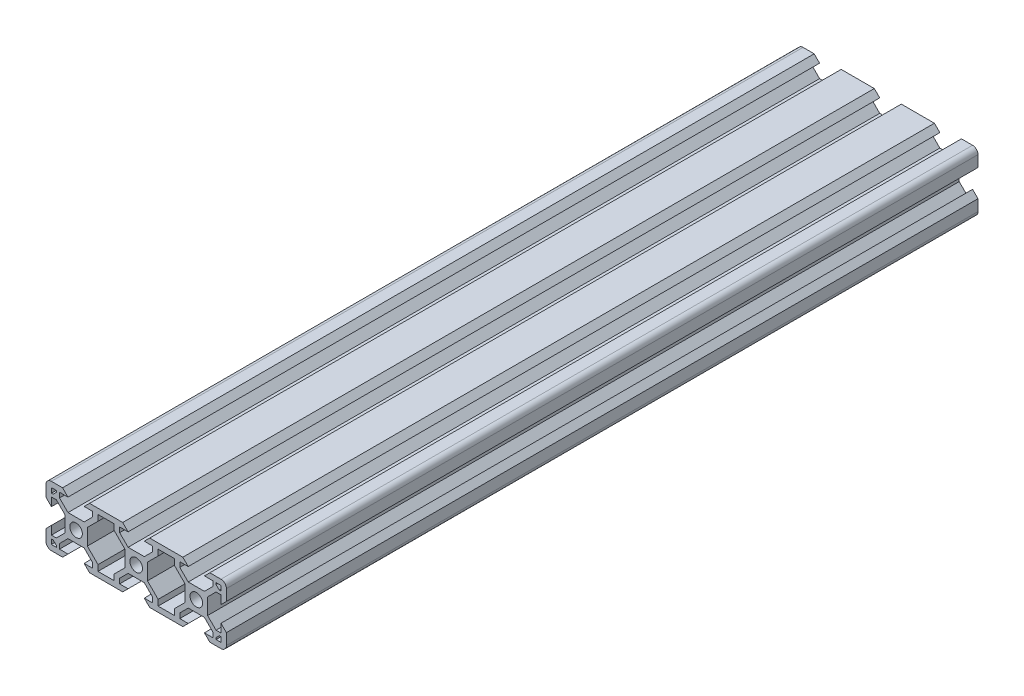
from build123d import *

# Parameters (mm, degrees)
ESQUISSE1_R        = 2.1
BOSS_EXTRU_1_DEPTH = 125


with BuildPart() as part:
    # Esquisse1 → Boss.-Extru.1 (new, symmetric)
    with BuildSketch(Plane.XY):
        with BuildLine():
            Line((-20, 3.750660172), (-22.69, 3.750660172))
            Line((-22.69, 3.750660172), (-25.499339828, 6.56))
            Line((-25.499339828, 6.56), (-25.499339828, 8.2))
            Line((-25.499339828, 8.2), (-22.69, 8.2))
            Line((-22.69, 8.2), (-24.49, 10))
            Line((-24.49, 10), (-28.2, 10))
            ThreePointArc((-28.2, 10), (-29.472792206, 9.472792206), (-30, 8.2))
            Line((-30, 8.2), (-30, 4.49))
            Line((-30, 4.49), (-28.2, 2.69))
            Line((-28.2, 2.69), (-28.2, 5.499339828))
            Line((-28.2, 5.499339828), (-26.56, 5.499339828))
            Line((-26.56, 5.499339828), (-23.750660172, 2.69))
            Line((-23.750660172, 2.69), (-23.750660172, 0))
            Line((-23.750660172, 0), (-23.750660172, -2.69))
            Line((-23.750660172, -2.69), (-26.56, -5.499339828))
            Line((-26.56, -5.499339828), (-28.2, -5.499339828))
            Line((-28.2, -5.499339828), (-28.2, -2.69))
            Line((-28.2, -2.69), (-30, -4.49))
            Line((-30, -4.49), (-30, -8.2))
            ThreePointArc((-30, -8.2), (-29.472792206, -9.472792206), (-28.2, -10))
            Line((-28.2, -10), (-24.49, -10))
            Line((-24.49, -10), (-22.69, -8.2))
            Line((-22.69, -8.2), (-25.499339828, -8.2))
            Line((-25.499339828, -8.2), (-25.499339828, -6.56))
            Line((-25.499339828, -6.56), (-22.69, -3.750660172))
            Line((-22.69, -3.750660172), (-20, -3.750660172))
            Line((-20, -3.750660172), (-17.31, -3.750660172))
            Line((-17.31, -3.750660172), (-14.500660172, -6.56))
            Line((-14.500660172, -6.56), (-14.500660172, -8.2))
            Line((-14.500660172, -8.2), (-17.31, -8.2))
            Line((-17.31, -8.2), (-15.51, -10))
            Line((-15.51, -10), (-4.49, -10))
            Line((-4.49, -10), (-2.69, -8.2))
            Line((-2.69, -8.2), (-5.499339828, -8.2))
            Line((-5.499339828, -8.2), (-5.499339828, -6.56))
            Line((-5.499339828, -6.56), (-2.69, -3.750660172))
            Line((-2.69, -3.750660172), (2.69, -3.750660172))
            Line((2.69, -3.750660172), (5.499339828, -6.56))
            Line((5.499339828, -6.56), (5.499339828, -8.2))
            Line((5.499339828, -8.2), (2.69, -8.2))
            Line((2.69, -8.2), (4.49, -10))
            Line((4.49, -10), (15.51, -10))
            Line((15.51, -10), (17.31, -8.2))
            Line((17.31, -8.2), (14.500660172, -8.2))
            Line((14.500660172, -8.2), (14.500660172, -6.56))
            Line((14.500660172, -6.56), (17.31, -3.750660172))
            Line((17.31, -3.750660172), (20, -3.750660172))
            Line((20, -3.750660172), (22.69, -3.750660172))
            Line((22.69, -3.750660172), (25.499339828, -6.56))
            Line((25.499339828, -6.56), (25.499339828, -8.2))
            Line((25.499339828, -8.2), (22.69, -8.2))
            Line((22.69, -8.2), (24.49, -10))
            Line((24.49, -10), (28.2, -10))
            ThreePointArc((28.2, -10), (29.472792206, -9.472792206), (30, -8.2))
            Line((30, -8.2), (30, -4.49))
            Line((30, -4.49), (28.2, -2.69))
            Line((28.2, -2.69), (28.2, -5.499339828))
            Line((28.2, -5.499339828), (26.56, -5.499339828))
            Line((26.56, -5.499339828), (23.750660172, -2.69))
            Line((23.750660172, -2.69), (23.750660172, 0))
            Line((23.750660172, 0), (23.750660172, 2.69))
            Line((23.750660172, 2.69), (26.56, 5.499339828))
            Line((26.56, 5.499339828), (28.2, 5.499339828))
            Line((28.2, 5.499339828), (28.2, 2.69))
            Line((28.2, 2.69), (30, 4.49))
            Line((30, 4.49), (30, 8.2))
            ThreePointArc((30, 8.2), (29.472792206, 9.472792206), (28.2, 10))
            Line((28.2, 10), (24.49, 10))
            Line((24.49, 10), (22.69, 8.2))
            Line((22.69, 8.2), (25.499339828, 8.2))
            Line((25.499339828, 8.2), (25.499339828, 6.56))
            Line((25.499339828, 6.56), (22.69, 3.750660172))
            Line((22.69, 3.750660172), (20, 3.750660172))
            Line((20, 3.750660172), (17.31, 3.750660172))
            Line((17.31, 3.750660172), (14.500660172, 6.56))
            Line((14.500660172, 6.56), (14.500660172, 8.2))
            Line((14.500660172, 8.2), (17.31, 8.2))
            Line((17.31, 8.2), (15.51, 10))
            Line((15.51, 10), (4.49, 10))
            Line((4.49, 10), (2.69, 8.2))
            Line((2.69, 8.2), (5.499339828, 8.2))
            Line((5.499339828, 8.2), (5.499339828, 6.56))
            Line((5.499339828, 6.56), (2.69, 3.750660172))
            Line((2.69, 3.750660172), (-2.69, 3.750660172))
            Line((-2.69, 3.750660172), (-5.499339828, 6.56))
            Line((-5.499339828, 6.56), (-5.499339828, 8.2))
            Line((-5.499339828, 8.2), (-2.69, 8.2))
            Line((-2.69, 8.2), (-4.49, 10))
            Line((-4.49, 10), (-15.51, 10))
            Line((-15.51, 10), (-17.31, 8.2))
            Line((-17.31, 8.2), (-14.500660172, 8.2))
            Line((-14.500660172, 8.2), (-14.500660172, 6.56))
            Line((-14.500660172, 6.56), (-17.31, 3.750660172))
            Line((-17.31, 3.750660172), (-20, 3.750660172))
        make_face()
        Circle(ESQUISSE1_R, mode=Mode.SUBTRACT)
        with Locations((-20, 0)):
            Circle(ESQUISSE1_R, mode=Mode.SUBTRACT)
        with Locations((20, 0)):
            Circle(ESQUISSE1_R, mode=Mode.SUBTRACT)
        Polygon((-28.2, 8.2), (-28.2, 6.569339828), (-27.63, 6.569339828), (-26.569339828, 7.63), (-26.569339828, 8.2), align=None, mode=Mode.SUBTRACT)
        Polygon((-26.569339828, -7.63), (-27.63, -6.569339828), (-28.2, -6.569339828), (-28.2, -8.2), (-26.569339828, -8.2), align=None, mode=Mode.SUBTRACT)
        Polygon((-7.300660172, -8.2), (-7.300660172, -6.24), (-3.750660172, -2.69), (-3.750660172, 2.69), (-7.300660172, 6.24), (-7.300660172, 8.2), (-12.699339828, 8.2), (-12.699339828, 6.24), (-16.249339828, 2.69), (-16.249339828, -2.69), (-12.699339828, -6.24), (-12.699339828, -8.2), align=None, mode=Mode.SUBTRACT)
        Polygon((26.569339828, 8.2), (28.2, 8.2), (28.2, 6.569339828), (27.63, 6.569339828), (26.569339828, 7.63), align=None, mode=Mode.SUBTRACT)
        Polygon((26.569339828, -8.2), (26.569339828, -7.63), (27.63, -6.569339828), (28.2, -6.569339828), (28.2, -8.2), align=None, mode=Mode.SUBTRACT)
        Polygon((7.300660172, 8.2), (7.300660172, 6.24), (3.750660172, 2.69), (3.750660172, -2.69), (7.300660172, -6.24), (7.300660172, -8.2), (12.699339828, -8.2), (12.699339828, -6.24), (16.249339828, -2.69), (16.249339828, 2.69), (12.699339828, 6.24), (12.699339828, 8.2), align=None, mode=Mode.SUBTRACT)
    extrude(amount=BOSS_EXTRU_1_DEPTH, both=True)


solid = part.part
